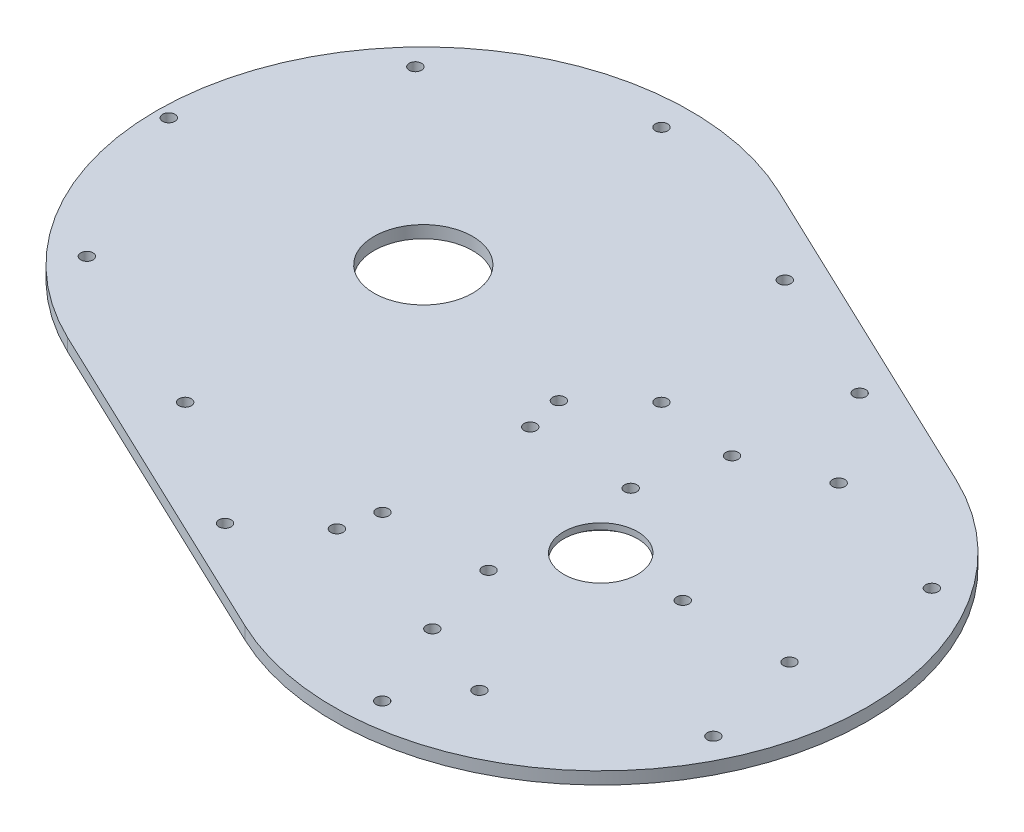
from build123d import *

# Parameters (mm, degrees)
SKETCH_1_R          = 1.5
SKETCH_1_R_2        = 9
SKETCH_1_R_3        = 12
EXTRUDE_1_DEPTH     = 3
SKETCH_3_R          = 1.5
CUT_EXTRUDE_1_DEPTH = 3
SKETCH_4_R          = 11
SKETCH_4_R_2        = 9
CUT_EXTRUDE_2_DEPTH = 1.5


with BuildPart() as part:
    # 草图1 → 凸台-拉伸1 (new body)
    with BuildSketch(Plane(origin=(0, 0, 0), x_dir=(1, 0, 0), z_dir=(0, 1, 0))):
        with BuildLine():
            ThreePointArc((-13.276439851, 97.89646317), (-99.89646317, 67.123560149), (-69.123560149, -19.49646317))
            Line((-69.123560149, -19.49646317), (13.276439851, -58.69646317))
            ThreePointArc((13.276439851, -58.69646317), (26.88689597, -63.404534956), (41.2, -65))
            ThreePointArc((41.2, -65), (104.604534956, -14.31310403), (69.123560149, 58.69646317))
            Line((69.123560149, 58.69646317), (-13.276439851, 97.89646317))
        make_face()
        with Locations((-83.95, 0)):
            Circle(SKETCH_1_R, mode=Mode.SUBTRACT)
        with Locations((-41.2, -18.801745663)):
            Circle(SKETCH_1_R, mode=Mode.SUBTRACT)
        with Locations((3.985218259, -27.038121605)):
            Circle(SKETCH_1_R, mode=Mode.SUBTRACT)
        with Locations((36.7, -36.5)):
            Circle(SKETCH_1_R, mode=Mode.SUBTRACT)
        with Locations((55.414781741, -43.74859975)):
            Circle(SKETCH_1_R, mode=Mode.SUBTRACT)
        with Locations((6.05, -18)):
            Circle(SKETCH_1_R, mode=Mode.SUBTRACT)
        with Locations((31.2, -17.320508076)):
            Circle(SKETCH_1_R, mode=Mode.SUBTRACT)
        with Locations((6.05, 18)):
            Circle(SKETCH_1_R, mode=Mode.SUBTRACT)
        with Locations((41.2, 0)):
            Circle(SKETCH_1_R_2, mode=Mode.SUBTRACT)
        with Locations((31.2, 17.320508076)):
            Circle(SKETCH_1_R, mode=Mode.SUBTRACT)
        with Locations((61.2, 0)):
            Circle(SKETCH_1_R, mode=Mode.SUBTRACT)
        with Locations((87.2, 0)):
            Circle(SKETCH_1_R, mode=Mode.SUBTRACT)
        with Locations((-103.2, 39.2)):
            Circle(SKETCH_1_R, mode=Mode.SUBTRACT)
        with Locations((-41.2, 39.2)):
            Circle(SKETCH_1_R_3, mode=Mode.SUBTRACT)
        with Locations((-83.95, 80)):
            Circle(SKETCH_1_R, mode=Mode.SUBTRACT)
        with Locations((-41.2, 97.201745663)):
            Circle(SKETCH_1_R, mode=Mode.SUBTRACT)
        with Locations((3.985218259, 27.038121605)):
            Circle(SKETCH_1_R, mode=Mode.SUBTRACT)
        with Locations((16.801745663, 39.2)):
            Circle(SKETCH_1_R, mode=Mode.SUBTRACT)
        with Locations((36.7, 36.5)):
            Circle(SKETCH_1_R, mode=Mode.SUBTRACT)
        with Locations((55.414781741, 43.74859975)):
            Circle(SKETCH_1_R, mode=Mode.SUBTRACT)
        with Locations((6.05, 80)):
            Circle(SKETCH_1_R, mode=Mode.SUBTRACT)
    extrude(amount=EXTRUDE_1_DEPTH)

    # 草图3 → 切除-拉伸1 (cut)
    with BuildSketch(Plane(origin=(0, 3, 0), x_dir=(1, 0, 0), z_dir=(0, 1, 0))):
        with Locations((88.967332321, 32.901131637)):
            Circle(SKETCH_3_R)
        with Locations((39.026482133, 65.264678963)):
            Circle(SKETCH_3_R)
        with Locations((45.80954965, -57.818289079)):
            Circle(SKETCH_3_R)
        with Locations((-10.807832752, -39.489084979)):
            Circle(SKETCH_3_R)
        with Locations((93.576881971, -24.917157442)):
            Circle(SKETCH_3_R)
    extrude(amount=-CUT_EXTRUDE_1_DEPTH, mode=Mode.SUBTRACT)

    # 草图4 → 切除-拉伸2 (cut)
    with BuildSketch(Plane.XZ):
        with Locations((41.2, 0)):
            Circle(SKETCH_4_R)
        with Locations((41.2, 0)):
            Circle(SKETCH_4_R_2, mode=Mode.SUBTRACT)
    extrude(amount=-CUT_EXTRUDE_2_DEPTH, mode=Mode.SUBTRACT)


solid = part.part
